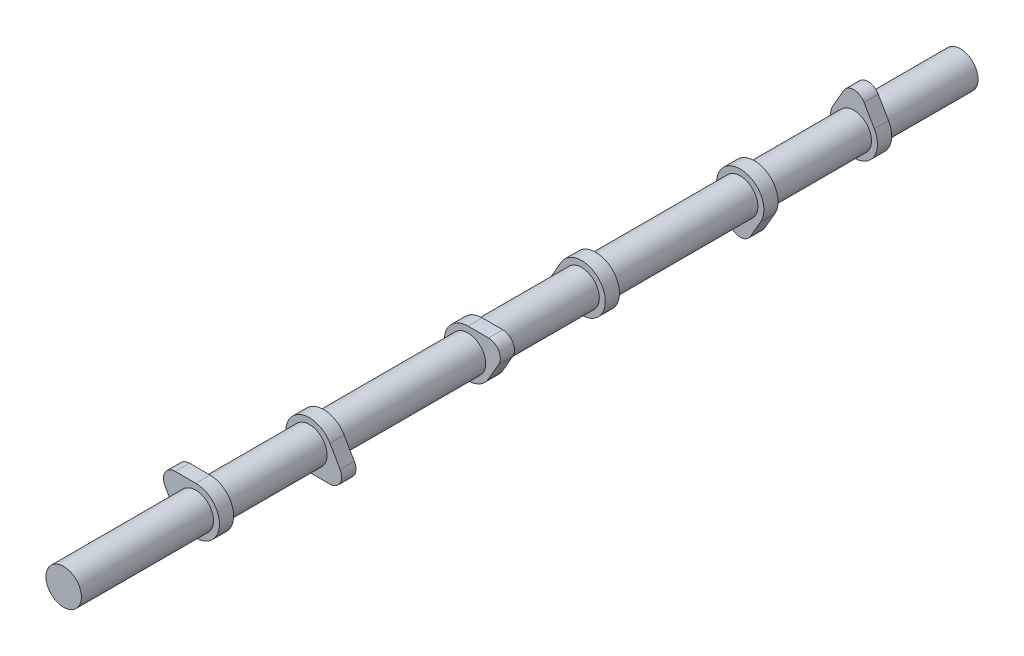
from build123d import *

# Parameters (mm, degrees)
BOSS_EXTRUDE1_DEPTH   = 3.81
BODY_MOVE_COPY2_ANGLE = 180
BOSS_EXTRUDE2_START   = -25.4
SKETCH2_R             = 9.5
BOSS_EXTRUDE2_DEPTH   = 146.05
LPATTERN1_COUNT       = 3
LPATTERN1_PITCH       = 146.05
BODY_MOVE_COPY3_ANGLE = 120
BODY_MOVE_COPY4_ANGLE = 120
BOSS_EXTRUDE3_START   = 27.94
SKETCH3_R             = 9.5
BOSS_EXTRUDE3_DEPTH   = 27.94
SKETCH4_R             = 9.5
BOSS_EXTRUDE4_DEPTH   = 15


with BuildPart() as part:
    # Sketch1 → Boss-Extrude1 (new, symmetric)
    with BuildSketch(Plane.XY):
        with BuildLine():
            Line((-5.499261314, 15.875), (-10.998522628, 6.35))
            ThreePointArc((-10.998522628, 6.35), (0, -12.7), (10.998522628, 6.35))
            Line((10.998522628, 6.35), (5.499261314, 15.875))
            ThreePointArc((5.499261314, 15.875), (0, 19.05), (-5.499261314, 15.875))
        make_face()
    extrude(amount=BOSS_EXTRUDE1_DEPTH, both=True)


with BuildPart() as body_2:
    # Body-Move/Copy1: copy of part
    add(part.part.moved(Location((0, 0, 60.96))))


with BuildPart() as body_2_1:
    # Body-Move/Copy2: moved
    add(body_2.part.rotate(Axis((0, 0, 0), (0, 0, 1)), BODY_MOVE_COPY2_ANGLE))


with BuildPart() as part_1:
    add(part.part)

    add(body_2_1.part)  # Boss-Extrude2 merges body 2
    # Sketch2 → Boss-Extrude2 (add)
    with BuildSketch(Plane.XY.offset(BOSS_EXTRUDE2_START)):
        Circle(SKETCH2_R)
    extrude(amount=BOSS_EXTRUDE2_DEPTH)


with BuildPart() as lpattern1_1:
    # LPattern1: pattern copy
    add(part_1.part.moved(Location(Vector(0, 0, 1) * (1 * LPATTERN1_PITCH))))


with BuildPart() as lpattern1_2:
    # LPattern1: pattern copy
    add(part_1.part.moved(Location(Vector(0, 0, 1) * (2 * LPATTERN1_PITCH))))


with BuildPart() as lpattern1_1_1:
    # Body-Move/Copy3: moved
    add(lpattern1_1.part.rotate(Axis((0, 0, 0), (0, 0, 1)), BODY_MOVE_COPY3_ANGLE))


with BuildPart() as lpattern1_2_1:
    # Body-Move/Copy4: moved
    add(lpattern1_2.part.rotate(Axis((0, 0, 0), (0, 0, -1)), BODY_MOVE_COPY4_ANGLE))


with BuildPart() as part_2:
    add(part_1.part)

    # Sketch3 → Boss-Extrude3 (add)
    with BuildSketch(Plane(origin=(0, 0, -25.4), x_dir=(-1, 0, 0), z_dir=(0, 0, -1)).offset(BOSS_EXTRUDE3_START)):
        Circle(SKETCH3_R)
    extrude(amount=-BOSS_EXTRUDE3_DEPTH)

    # Combine1: union LPattern1_1, LPattern1_2
    add(lpattern1_1_1.part)
    add(lpattern1_2_1.part)

    # Sketch4 → Boss-Extrude4 (add)
    with BuildSketch(Plane.XY.offset(412.75)):
        Circle(SKETCH4_R)
    extrude(amount=BOSS_EXTRUDE4_DEPTH)


solid = part_2.part
